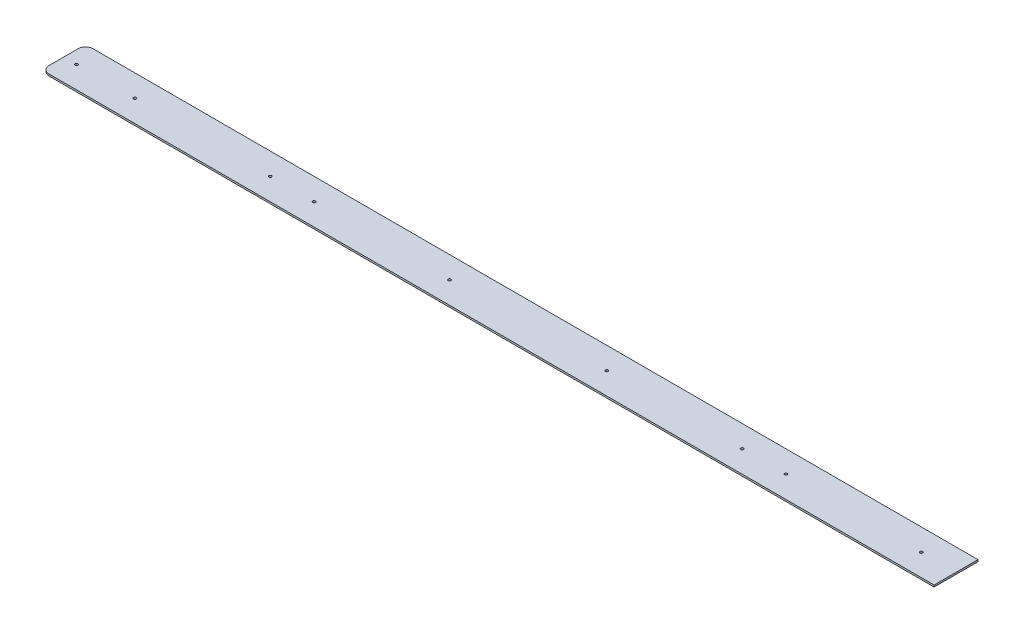
from build123d import *

# Parameters (mm, degrees)
SKETCH1_R      = 2.3876
EXTRUDE1_DEPTH = 3.175


with BuildPart() as part:
    # Sketch1 → Extrude1 (new body)
    with BuildSketch(Plane(origin=(0, 0, 0), x_dir=(-1, 0, 0), z_dir=(0, 1, 0))):
        with BuildLine():
            Line((0, 38.1), (0, -38.1))
            Line((0, -38.1), (1536.7, -38.1))
            ThreePointArc((1536.7, -38.1), (1545.680256121, -34.380256121), (1549.4, -25.4))
            Line((1549.4, -25.4), (1549.4, 25.4))
            ThreePointArc((1549.4, 25.4), (1545.680256121, 34.380256121), (1536.7, 38.1))
            Line((1536.7, 38.1), (0, 38.1))
        make_face()
        with Locations(Location((60.325, 0, 0), (0, 0, 90))):
            Circle(SKETCH1_R, mode=Mode.SUBTRACT)
        with Locations(Location((295.275, 0, 0), (0, 0, 90))):
            Circle(SKETCH1_R, mode=Mode.SUBTRACT)
        with Locations(Location((371.475, 0, 0), (0, 0, 90))):
            Circle(SKETCH1_R, mode=Mode.SUBTRACT)
        with Locations(Location((606.425, 0, 0), (0, 0, 90))):
            Circle(SKETCH1_R, mode=Mode.SUBTRACT)
        with Locations(Location((879.475, 0, 0), (0, 0, 90))):
            Circle(SKETCH1_R, mode=Mode.SUBTRACT)
        with Locations(Location((1114.425, 0, 0), (0, 0, 90))):
            Circle(SKETCH1_R, mode=Mode.SUBTRACT)
        with Locations(Location((1190.625, 0, 0), (0, 0, 90))):
            Circle(SKETCH1_R, mode=Mode.SUBTRACT)
        with Locations(Location((1425.575, 0, 0), (0, 0, 90))):
            Circle(SKETCH1_R, mode=Mode.SUBTRACT)
        with Locations(Location((1527.175, 0, 0), (0, 0, 90))):
            Circle(SKETCH1_R, mode=Mode.SUBTRACT)
    extrude(amount=-EXTRUDE1_DEPTH)


solid = part.part
